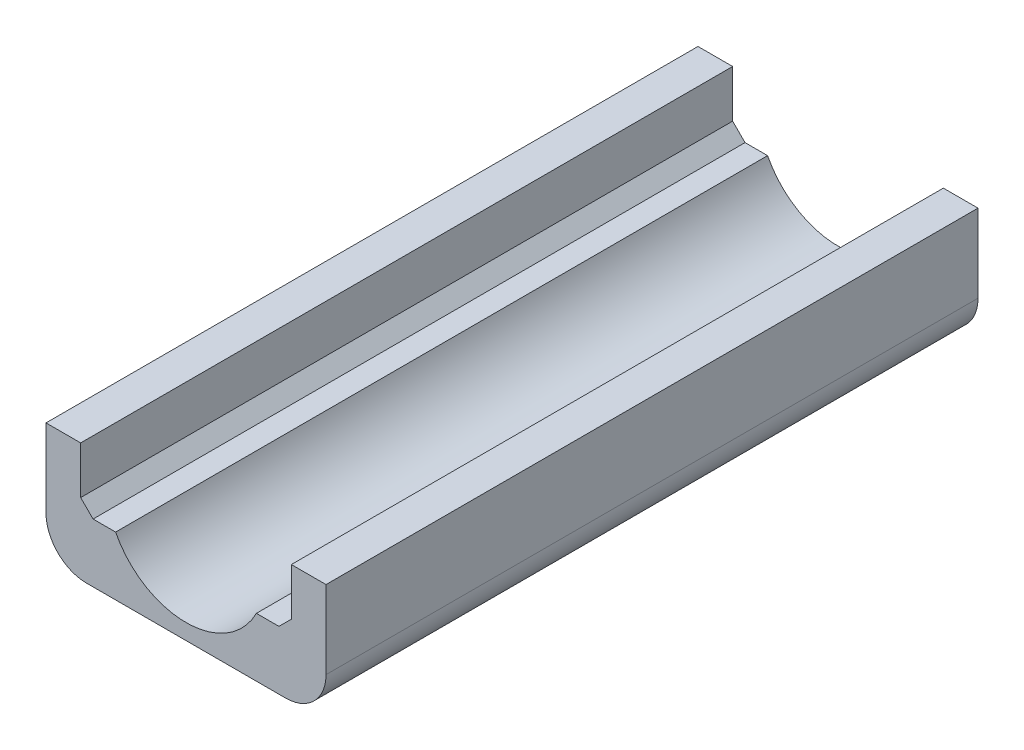
from build123d import *

# Parameters (mm, degrees)
BOSS_EXTRUDE1_DEPTH = 161


with BuildPart() as part:
    # Sketch1 → Boss-Extrude1 (new body)
    with BuildSketch(Plane.XY):
        with BuildLine():
            Line((-22.496419286, 29.27), (-22.496419286, 10))
            ThreePointArc((-22.496419286, 10), (-19.567487097, 2.928932188), (-12.496419286, 0))
            Line((-12.496419286, 0), (36.648732275, 0))
            ThreePointArc((36.648732275, 0), (43.719800087, 2.928932188), (46.648732275, 10))
            Line((46.648732275, 10), (46.648732275, 29.27))
            Line((46.648732275, 29.27), (38.088732275, 29.27))
            Line((38.088732275, 29.27), (38.088732275, 17.58))
            Line((38.088732275, 17.58), (35.026959912, 14.518227637))
            Line((35.026959912, 14.518227637), (29.456959912, 14.518227637))
            ThreePointArc((29.456959912, 14.518227637), (12.076156495, 3.858910448), (-5.304646923, 14.518227637))
            Line((-5.304646923, 14.518227637), (-10.874646923, 14.518227637))
            Line((-10.874646923, 14.518227637), (-13.936419286, 17.58))
            Line((-13.936419286, 17.58), (-13.936419286, 29.27))
            Line((-13.936419286, 29.27), (-22.496419286, 29.27))
        make_face()
    extrude(amount=BOSS_EXTRUDE1_DEPTH)


solid = part.part
